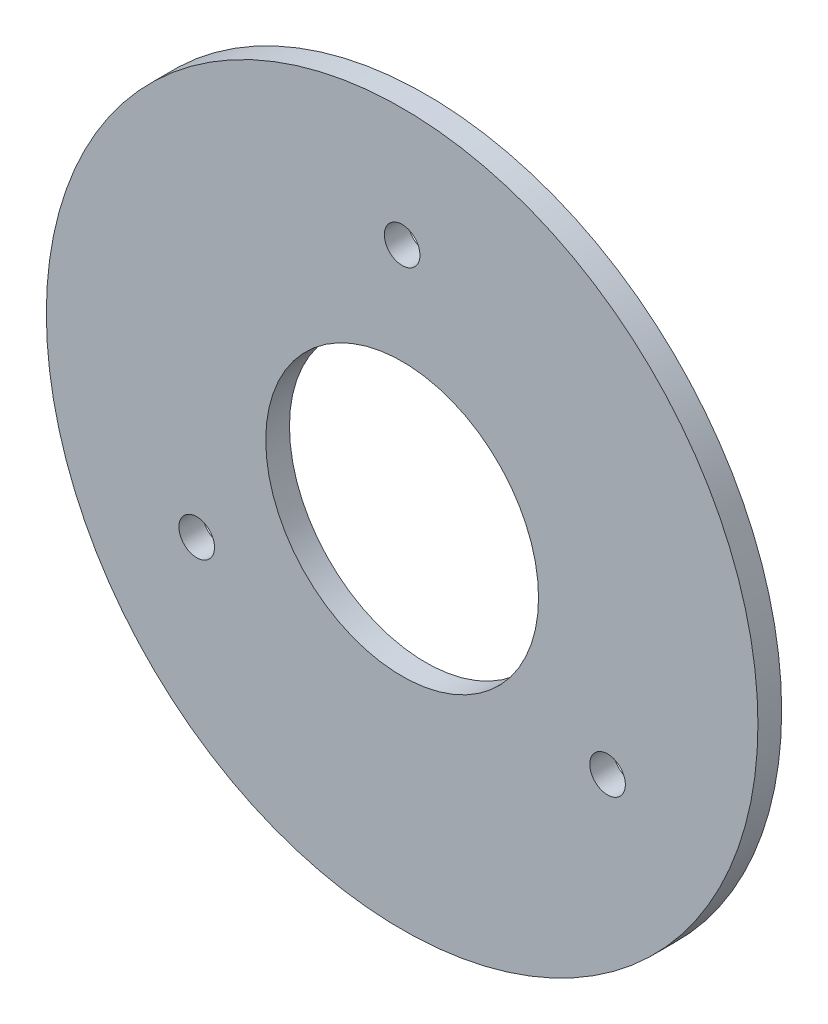
from build123d import *

# Parameters (mm, degrees)
SKETCH_1_R      = 30
SKETCH_1_R_2    = 11.5
SKETCH_1_R_3    = 1.5
EXTRUDE_1_DEPTH = 2


with BuildPart() as part:
    # 草图1 → 凸台-拉伸1 (new body)
    with BuildSketch(Plane.XY):
        Circle(SKETCH_1_R)
        Circle(SKETCH_1_R_2, mode=Mode.SUBTRACT)
        with Locations((0, 20)):
            Circle(SKETCH_1_R_3, mode=Mode.SUBTRACT)
        with Locations((17.320508076, -10)):
            Circle(SKETCH_1_R_3, mode=Mode.SUBTRACT)
        with Locations((-17.320508076, -10)):
            Circle(SKETCH_1_R_3, mode=Mode.SUBTRACT)
    extrude(amount=EXTRUDE_1_DEPTH)


solid = part.part
